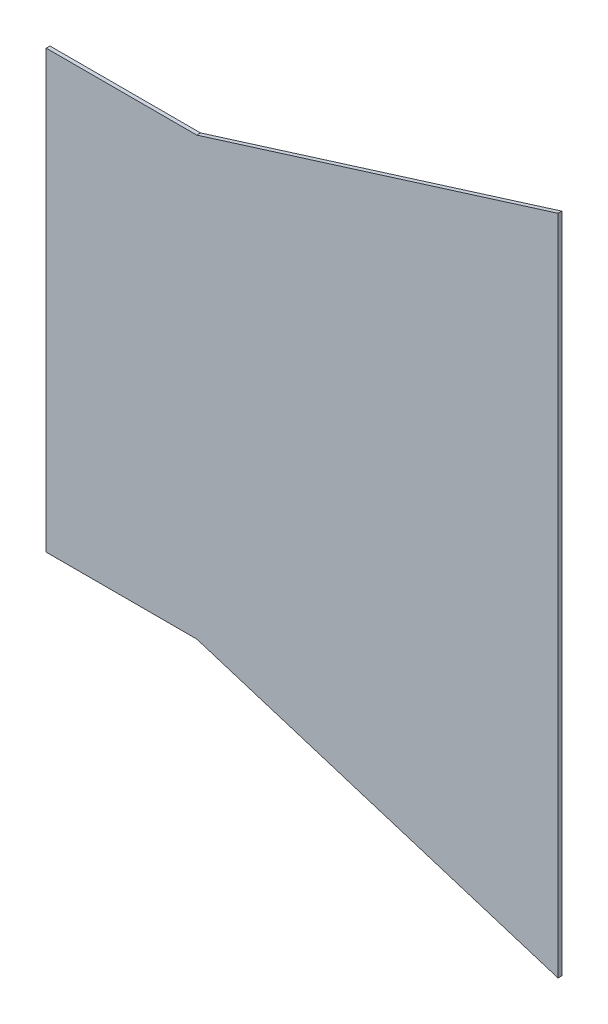
from build123d import *

# Parameters (mm, degrees)
BOSS_EXTRUDE1_DEPTH = 3.175


with BuildPart() as part:
    # Sketch1 → Boss-Extrude1 (new body)
    with BuildSketch(Plane(origin=(0, 0, 0), x_dir=(0, 1, 0), z_dir=(0, 0, 1))):
        Polygon((-368.3, -127), (-368.3, 0), (0, 0), (0, -127), (95.25, -431.8), (-463.55, -431.8), align=None)
    extrude(amount=BOSS_EXTRUDE1_DEPTH)


solid = part.part
